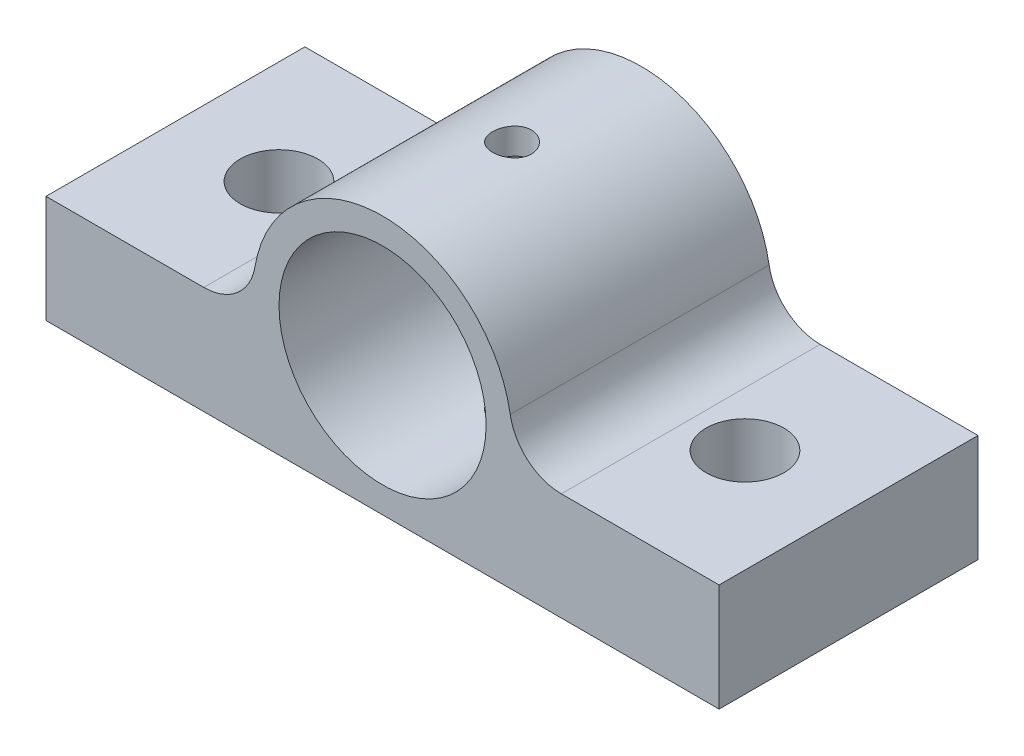
from build123d import *
from build123d.topology import SkipClean

# Parameters (mm, degrees)
BOSS_EXTRUDE1_DEPTH     = 10
SKETCH2_R               = 1.5
CUT_EXTRUDE1_DEPTH      = 10
CUT_EXTRUDE2_DEPTH      = 18.411616553
CUT_EXTRUDE2_DEPTH_BACK = 18.411616553
SKETCH3_R               = 0.75


with BuildPart() as part:
    # Sketch1 → Boss-Extrude1 (new body)
    with BuildSketch(Plane.XY):
        with BuildLine():
            Line((0, 1), (0, 0))
            Line((0, 0), (13, 0))
            Line((13, 0), (13, 4.154968692))
            Line((13, 4.154968692), (6.904060206, 4.154968692))
            ThreePointArc((6.904060206, 4.154968692), (5.611771946, 4.62853787), (4.931471575, 5.824977637))
            ThreePointArc((4.931471575, 5.824977637), (3.230720648, 8.816077055), (0, 10))
            Line((0, 10), (0, 9))
            ThreePointArc((0, 9), (2.828427125, 7.828427125), (4, 5))
            ThreePointArc((4, 5), (2.828427125, 2.171572875), (0, 1))
        make_face()
        with BuildLine():
            Line((-13, 0), (0, 0))
            Line((0, 0), (0, 1))
            ThreePointArc((0, 1), (-4, 5), (0, 9))
            Line((0, 9), (0, 10))
            ThreePointArc((0, 10), (-3.230720648, 8.816077055), (-4.931471575, 5.824977637))
            ThreePointArc((-4.931471575, 5.824977637), (-5.611771946, 4.62853787), (-6.904060206, 4.154968692))
            Line((-6.904060206, 4.154968692), (-13, 4.154968692))
            Line((-13, 4.154968692), (-13, 0))
        make_face()
    extrude(amount=BOSS_EXTRUDE1_DEPTH)

    # Sketch2 → Cut-Extrude1 (cut)
    with BuildSketch(Plane(origin=(0, 4.154968692, 0), x_dir=(1, 0, 0), z_dir=(0, 1, 0))):
        with Locations(Location((-9, -5, 0), (0, 0, 270))):
            Circle(SKETCH2_R)
        with Locations(Location((9, -5, 0), (0, 0, 270))):
            Circle(SKETCH2_R)
    extrude(amount=-CUT_EXTRUDE1_DEPTH, mode=Mode.SUBTRACT)

    # Sketch3 → Cut-Extrude2 (cut, two sides: drawn at the far end of the back side and taken through both)
    with SkipClean():  # the faces are left unmerged after this step: merging them gives an invalid solid
        with BuildSketch(Plane(origin=(0, 4.154968692, 0), x_dir=(1, 0, 0), z_dir=(0, 1, 0)).offset(-CUT_EXTRUDE2_DEPTH_BACK)):
            with Locations(Location((0, -5, 0), (0, 0, 270))):
                Circle(SKETCH3_R)
        extrude(amount=CUT_EXTRUDE2_DEPTH + CUT_EXTRUDE2_DEPTH_BACK, mode=Mode.SUBTRACT)


solid = part.part
